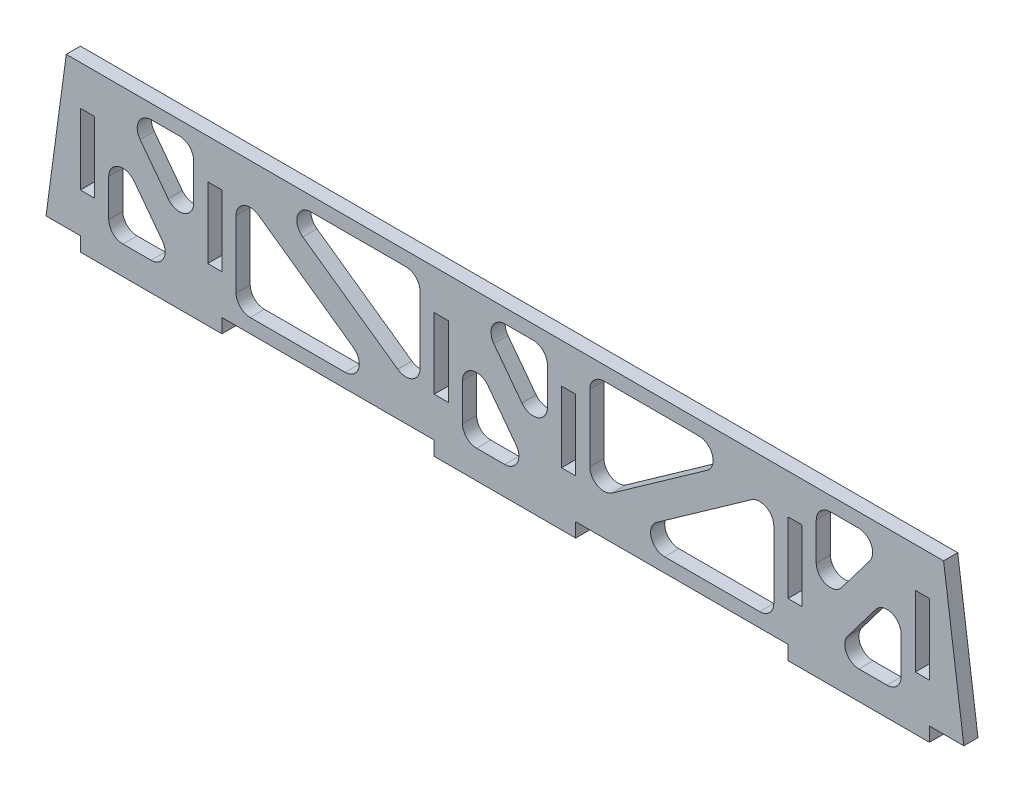
from build123d import *

# Parameters (mm, degrees)
SKETCH2_W           = 4
SKETCH2_H           = 20
BOSS_EXTRUDE1_DEPTH = 4


with BuildPart() as part:
    # Sketch2 → Boss-Extrude1 (new body)
    with BuildSketch(Plane.XY):
        Polygon((124, 0), (-124, 0), (-129.725981227, -42.426406871), (-120, -42.426406871), (-120, -46.426406871), (-80, -46.426406871), (-80, -42.426406871), (-20, -42.426406871), (-20, -46.426406871), (20, -46.426406871), (20, -42.426406871), (80, -42.426406871), (80, -46.426406871), (120, -46.426406871), (120, -42.426406871), (129.725981227, -42.426406871), align=None)
        with BuildLine():
            Line((-88, -18.534474898), (-88, -8))
            ThreePointArc((-88, -8), (-89.171572875, -5.171572875), (-92, -4))
            Line((-92, -4), (-99.945598546, -4))
            ThreePointArc((-99.945598546, -4), (-103.525730324, -6.215999874), (-103.139076318, -10.408671774))
            Line((-103.139076318, -10.408671774), (-95.193477772, -20.943146672))
            ThreePointArc((-95.193477772, -20.943146672), (-90.729943129, -22.327488943), (-88, -18.534474898))
        make_face(mode=Mode.SUBTRACT)
        with BuildLine():
            Line((-108, -38.426406871), (-100.054401454, -38.426406871))
            ThreePointArc((-100.054401454, -38.426406871), (-96.474269676, -36.210406998), (-96.860923682, -32.017735097))
            Line((-96.860923682, -32.017735097), (-104.806522228, -21.483260199))
            ThreePointArc((-104.806522228, -21.483260199), (-109.270056871, -20.098917928), (-112, -23.891931973))
            Line((-112, -23.891931973), (-112, -34.426406871))
            ThreePointArc((-112, -34.426406871), (-110.828427125, -37.254833996), (-108, -38.426406871))
        make_face(mode=Mode.SUBTRACT)
        with BuildLine():
            Line((-57.139286117, -11.265986324), (-30.309401077, -30.237579974))
            ThreePointArc((-30.309401077, -30.237579974), (-26.161196626, -30.523888986), (-24, -26.971593651))
            Line((-24, -26.971593651), (-24, -8))
            ThreePointArc((-24, -8), (-25.171572875, -5.171572875), (-28, -4))
            Line((-28, -4), (-54.82988504, -4))
            ThreePointArc((-54.82988504, -4), (-58.641967496, -6.788378214), (-57.139286117, -11.265986324))
        make_face(mode=Mode.SUBTRACT)
        with BuildLine():
            Line((-42.860713883, -31.160420547), (-69.690598923, -12.188826897))
            ThreePointArc((-69.690598923, -12.188826897), (-73.838803374, -11.902517885), (-76, -15.454813221))
            Line((-76, -15.454813221), (-76, -34.426406871))
            ThreePointArc((-76, -34.426406871), (-74.828427125, -37.254833996), (-72, -38.426406871))
            Line((-72, -38.426406871), (-45.17011496, -38.426406871))
            ThreePointArc((-45.17011496, -38.426406871), (-41.358032504, -35.638028657), (-42.860713883, -31.160420547))
        make_face(mode=Mode.SUBTRACT)
        with BuildLine():
            Line((3.139076318, -32.017735097), (-4.806522228, -21.483260199))
            ThreePointArc((-4.806522228, -21.483260199), (-9.270056871, -20.098917928), (-12, -23.891931973))
            Line((-12, -23.891931973), (-12, -34.426406871))
            ThreePointArc((-12, -34.426406871), (-10.828427125, -37.254833996), (-8, -38.426406871))
            Line((-8, -38.426406871), (-0.054401454, -38.426406871))
            ThreePointArc((-0.054401454, -38.426406871), (3.525730324, -36.210406998), (3.139076318, -32.017735097))
        make_face(mode=Mode.SUBTRACT)
        with BuildLine():
            Line((12, -18.534474898), (12, -8))
            ThreePointArc((12, -8), (10.828427125, -5.171572875), (8, -4))
            Line((8, -4), (0.054401454, -4))
            ThreePointArc((0.054401454, -4), (-3.525730324, -6.215999874), (-3.139076318, -10.408671774))
            Line((-3.139076318, -10.408671774), (4.806522228, -20.943146672))
            ThreePointArc((4.806522228, -20.943146672), (9.270056871, -22.327488943), (12, -18.534474898))
        make_face(mode=Mode.SUBTRACT)
        with BuildLine():
            Line((112, -23.891931973), (112, -34.426406871))
            ThreePointArc((112, -34.426406871), (110.828427125, -37.254833996), (108, -38.426406871))
            Line((108, -38.426406871), (100.054401454, -38.426406871))
            ThreePointArc((100.054401454, -38.426406871), (96.474269676, -36.210406998), (96.860923682, -32.017735097))
            Line((96.860923682, -32.017735097), (104.806522228, -21.483260199))
            ThreePointArc((104.806522228, -21.483260199), (109.270056871, -20.098917928), (112, -23.891931973))
        make_face(mode=Mode.SUBTRACT)
        with BuildLine():
            Line((103.139076318, -10.408671774), (95.193477772, -20.943146672))
            ThreePointArc((95.193477772, -20.943146672), (90.729943129, -22.327488943), (88, -18.534474898))
            Line((88, -18.534474898), (88, -8))
            ThreePointArc((88, -8), (89.171572875, -5.171572875), (92, -4))
            Line((92, -4), (99.945598546, -4))
            ThreePointArc((99.945598546, -4), (103.525730324, -6.215999874), (103.139076318, -10.408671774))
        make_face(mode=Mode.SUBTRACT)
        with BuildLine():
            Line((28, -4), (54.82988504, -4))
            ThreePointArc((54.82988504, -4), (58.641967496, -6.788378214), (57.139286117, -11.265986324))
            Line((57.139286117, -11.265986324), (30.309401077, -30.237579974))
            ThreePointArc((30.309401077, -30.237579974), (26.161196626, -30.523888986), (24, -26.971593651))
            Line((24, -26.971593651), (24, -8))
            ThreePointArc((24, -8), (25.171572875, -5.171572875), (28, -4))
        make_face(mode=Mode.SUBTRACT)
        with BuildLine():
            Line((72, -38.426406871), (45.17011496, -38.426406871))
            ThreePointArc((45.17011496, -38.426406871), (41.358032504, -35.638028657), (42.860713883, -31.160420547))
            Line((42.860713883, -31.160420547), (69.690598923, -12.188826897))
            ThreePointArc((69.690598923, -12.188826897), (73.838803374, -11.902517885), (76, -15.454813221))
            Line((76, -15.454813221), (76, -34.426406871))
            ThreePointArc((76, -34.426406871), (74.828427125, -37.254833996), (72, -38.426406871))
        make_face(mode=Mode.SUBTRACT)
        with Locations((-118, -21.213203436)):
            Rectangle(SKETCH2_W, SKETCH2_H, mode=Mode.SUBTRACT)
        with Locations((-18, -21.213203436)):
            Rectangle(SKETCH2_W, SKETCH2_H, mode=Mode.SUBTRACT)
        with Locations((-82, -21.213203436)):
            Rectangle(SKETCH2_W, SKETCH2_H, mode=Mode.SUBTRACT)
        with Locations((18, -21.213203436)):
            Rectangle(SKETCH2_W, SKETCH2_H, mode=Mode.SUBTRACT)
        with Locations((82, -21.213203436)):
            Rectangle(SKETCH2_W, SKETCH2_H, mode=Mode.SUBTRACT)
        with Locations((118, -21.213203436)):
            Rectangle(SKETCH2_W, SKETCH2_H, mode=Mode.SUBTRACT)
    extrude(amount=BOSS_EXTRUDE1_DEPTH)


solid = part.part
